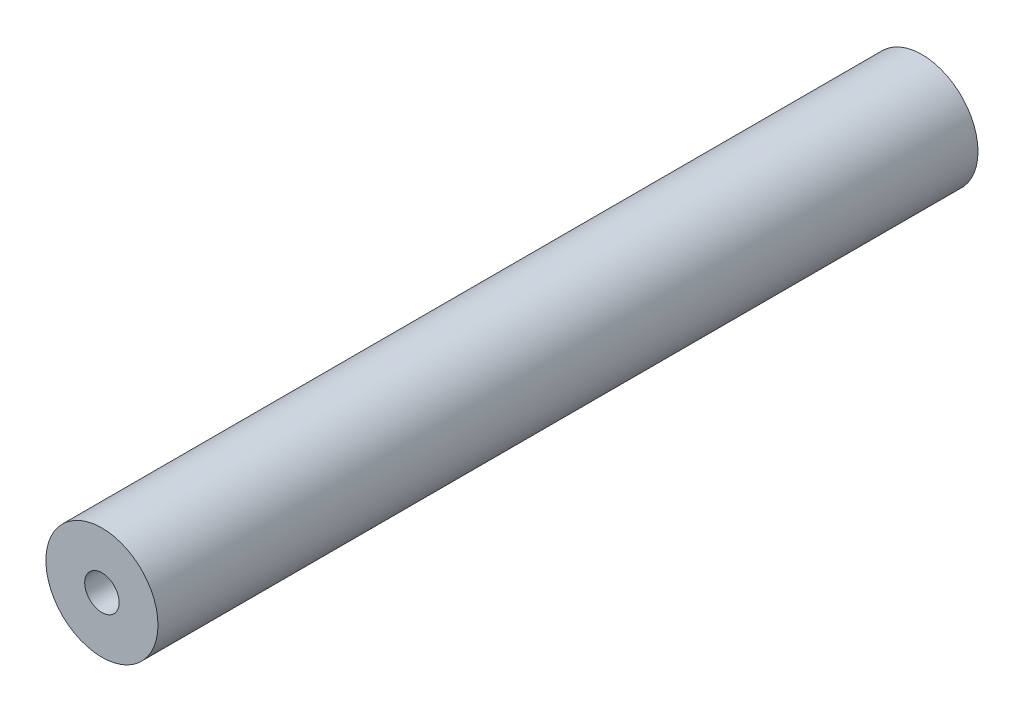
from build123d import *

# Parameters (mm, degrees)
CROQUIS1_R              = 2.05
CROQUIS1_R_2            = 0.63
SALIENTE_EXTRUIR1_DEPTH = 30


with BuildPart() as part:
    # Croquis1 → Saliente-Extruir1 (new body)
    with BuildSketch(Plane.XY):
        Circle(CROQUIS1_R)
        Circle(CROQUIS1_R_2, mode=Mode.SUBTRACT)
    extrude(amount=SALIENTE_EXTRUIR1_DEPTH)


solid = part.part
